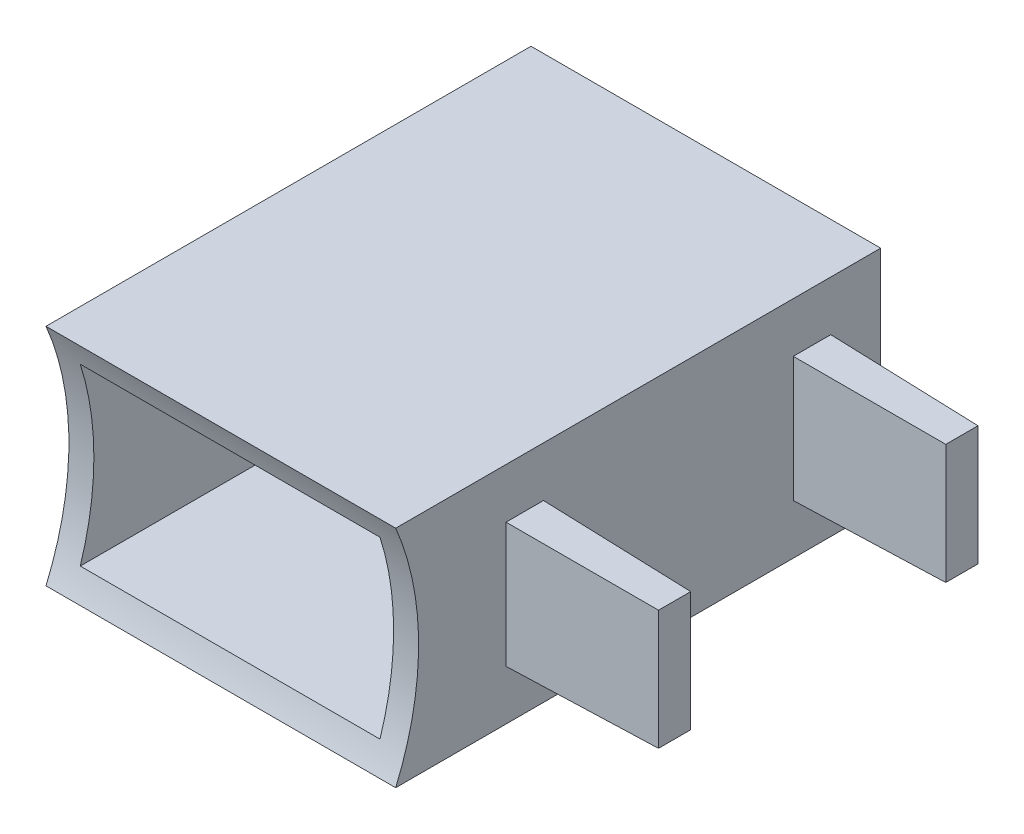
from build123d import *

# Parameters (mm, degrees)
SKETCH9_W                     = 12
SKETCH9_H                     = 7
BOSS_EXTRUDE5_DEPTH           = 25
SHELL6_T                      = 1
CUT_EXTRUDE2_REACH            = 31.004
SKETCH12_R                    = 11.5
SKETCH14_W                    = 14
SKETCH14_H                    = 9
SKETCH14_W_2                  = 12
SKETCH14_H_2                  = 7
BOSS_EXTRUDE6_DEPTH           = 5
CHAMFER2_SIZE                 = 0.5
CHAMFER2_SIZE2                = 0.866025404
SKETCH16_W                    = 5
SKETCH16_H                    = 1.5
BOSS_EXTRUDE7_DEPTH           = 6
BOSS_EXTRUDE7_DRAFT           = 1
BOSS_EXTRUDE7_PROFILE_2_DEPTH = 6
BOSS_EXTRUDE7_PROFILE_2_DRAFT = 1
BODY_MOVE_COPY1_ANGLE         = 90


with BuildPart() as part:
    # Sketch9 → Boss-Extrude5 (new body)
    with BuildSketch(Plane(origin=(0, 0, 0), x_dir=(1, 0, 0), z_dir=(0, 1, 0))):
        Rectangle(SKETCH9_W, SKETCH9_H)
    extrude(amount=BOSS_EXTRUDE5_DEPTH)

    # Shell6
    shell6_openings = [part.faces().sort_by_distance(p)[0] for p in [
        (0, 0, 0),
        (0, 25, 0),
    ]]
    offset(amount=SHELL6_T, openings=shell6_openings, kind=Kind.INTERSECTION)

    # Sketch12 → Cut-Extrude2 (cut, up to next)
    with BuildSketch(Plane(origin=(7, 0, 0), x_dir=(0, 0, -1), z_dir=(1, 0, 0)), mode=Mode.PRIVATE) as cut_extrude2_sk1:
        Circle(SKETCH12_R)
    cut_extrude2_tool1 = extrude(cut_extrude2_sk1.sketch, amount=-CUT_EXTRUDE2_REACH, mode=Mode.PRIVATE) & part.part
    add(cut_extrude2_tool1.solids().sort_by_distance((7, 0, 0))[0], mode=Mode.SUBTRACT)

    # Sketch14 → Boss-Extrude6 (add)
    with BuildSketch(Plane(origin=(0, 25, 0), x_dir=(1, 0, 0), z_dir=(0, 1, 0))):
        Rectangle(SKETCH14_W, SKETCH14_H)
        Rectangle(SKETCH14_W_2, SKETCH14_H_2, mode=Mode.SUBTRACT)
    extrude(amount=BOSS_EXTRUDE6_DEPTH)

    # Chamfer2
    chamfer2_edges = [part.edges().sort_by_distance(p)[0] for p in [
        (6, 30, 0),
        (0, 30, -3.5),
        (-6, 30, 0),
        (0, 30, 3.5),
    ]]
    chamfer2_side = [part.faces().sort_by_distance(p)[0] for p in [
        (0, 30, -4.33356683),
    ]]
    chamfer(chamfer2_edges, length=CHAMFER2_SIZE, length2=CHAMFER2_SIZE2, reference=chamfer2_side[0])


with BuildPart() as boss_extrude7_tool:
    # Sketch16 → Boss-Extrude7 (with draft: the straight prism first)
    with BuildSketch(Plane(origin=(7, 0, 0), x_dir=(0, 0, -1), z_dir=(1, 0, 0))):
        with Locations((0, 27.25)):
            Rectangle(SKETCH16_W, SKETCH16_H)
    extrude(amount=BOSS_EXTRUDE7_DEPTH)
    # Boss-Extrude7: the draft: its side faces are tilted about the plane it starts from
    boss_extrude7_sides = [boss_extrude7_tool.faces().sort_by_distance(p)[0] for p in [
        (10, 27.25, 2.5),
        (10, 26.5, 0),
        (10, 27.25, -2.5),
        (10, 28, 0),
    ]]
    draft(boss_extrude7_sides, Plane(origin=(7, 0, 0), x_dir=(0, 0, -1), z_dir=(1, 0, 0)), BOSS_EXTRUDE7_DRAFT)


with BuildPart() as part_1:
    add(part.part)

    # Boss-Extrude7: add boss_extrude7_tool
    add(boss_extrude7_tool.part)


with BuildPart() as boss_extrude7_profile_2_tool:
    # Sketch16 → Boss-Extrude7 profile 2 (with draft: the straight prism first)
    with BuildSketch(Plane(origin=(7, 0, 0), x_dir=(0, 0, -1), z_dir=(1, 0, 0))):
        with Locations((0, 15.75)):
            Rectangle(SKETCH16_W, SKETCH16_H)
    extrude(amount=BOSS_EXTRUDE7_PROFILE_2_DEPTH)
    # Boss-Extrude7 profile 2: the draft: its side faces are tilted about the plane it starts from
    boss_extrude7_profile_2_sides = [boss_extrude7_profile_2_tool.faces().sort_by_distance(p)[0] for p in [
        (10, 15.75, 2.5),
        (10, 15, 0),
        (10, 15.75, -2.5),
        (10, 16.5, 0),
    ]]
    draft(boss_extrude7_profile_2_sides, Plane(origin=(7, 0, 0), x_dir=(0, 0, -1), z_dir=(1, 0, 0)), BOSS_EXTRUDE7_PROFILE_2_DRAFT)


with BuildPart() as part_2:
    add(part_1.part)

    # Boss-Extrude7 profile 2: add boss_extrude7_profile_2_tool
    add(boss_extrude7_profile_2_tool.part)


with BuildPart() as part_3:
    # Body-Move/Copy1: moved
    add(part_2.part.rotate(Axis((0, 20.291502622, 0), (-1, 0, 0)), BODY_MOVE_COPY1_ANGLE))


solid = part_3.part
